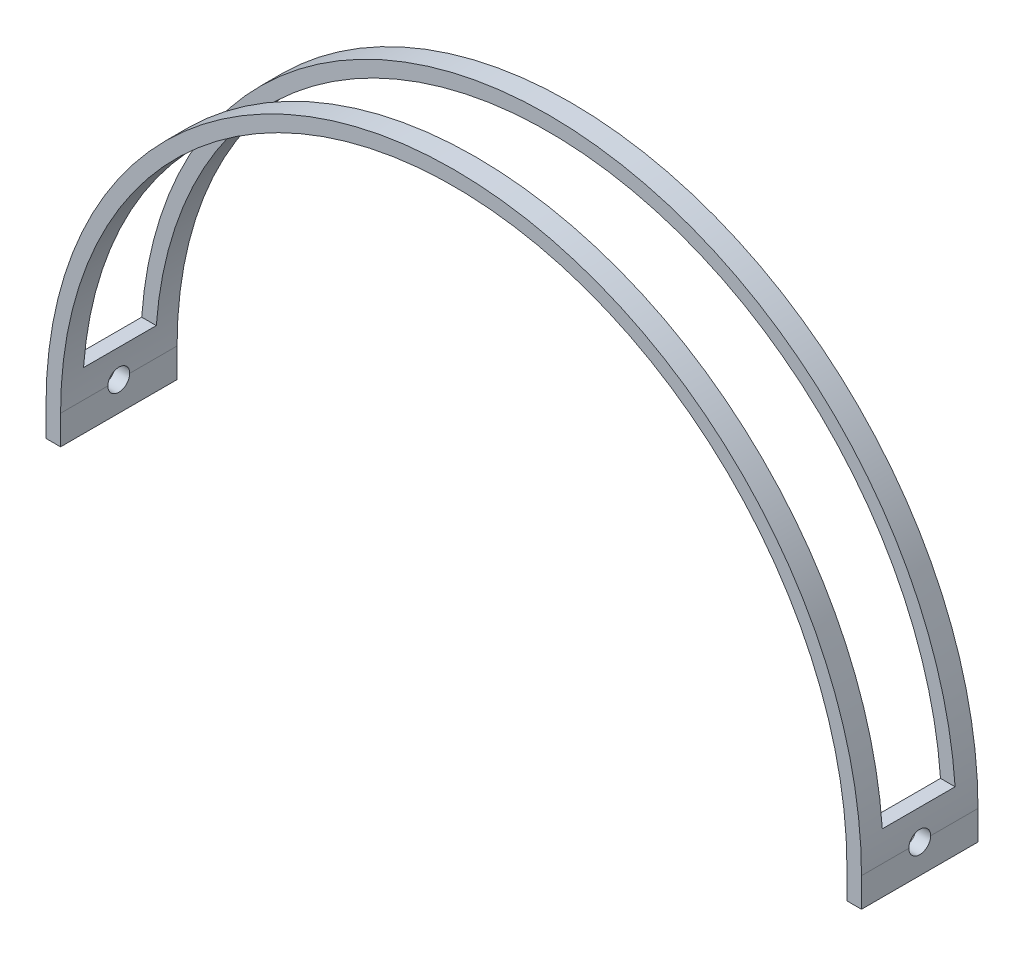
from build123d import *

# Parameters (mm, degrees)
BOSS_EXTRUDE1_DEPTH = 80
SKETCH2_R           = 7.5
CUT_EXTRUDE2_DEPTH  = 632.189353522
SKETCH4_W           = 50
SKETCH4_H           = 260
CUT_EXTRUDE3_DEPTH  = 632.189353668


with BuildPart() as part:
    # Sketch1 → Boss-Extrude1 (new body)
    with BuildSketch(Plane.XY):
        with BuildLine():
            Line((-280, 0), (-280, -20))
            Line((-280, -20), (-270, -20))
            Line((-270, -20), (-270, 0))
            ThreePointArc((-270, 0), (0, 270), (270, 0))
            Line((270, 0), (270, -20))
            Line((270, -20), (280, -20))
            Line((280, -20), (280, 0))
            ThreePointArc((280, 0), (0, 280), (-280, 0))
        make_face()
    extrude(amount=BOSS_EXTRUDE1_DEPTH)

    # Sketch2 → Cut-Extrude2 (cut, through all)
    with BuildSketch(Plane(origin=(280, 0, 0), x_dir=(0, 0, -1), z_dir=(1, 0, 0))):
        with Locations((-40, 0)):
            Circle(SKETCH2_R)
    extrude(amount=-CUT_EXTRUDE2_DEPTH, mode=Mode.SUBTRACT)

    # Sketch4 → Cut-Extrude3 (cut, through all)
    with BuildSketch(Plane(origin=(280, 0, 0), x_dir=(0, 0, -1), z_dir=(1, 0, 0))):
        with Locations((-40, 150)):
            Rectangle(SKETCH4_W, SKETCH4_H)
    extrude(amount=-CUT_EXTRUDE3_DEPTH, mode=Mode.SUBTRACT)


solid = part.part
